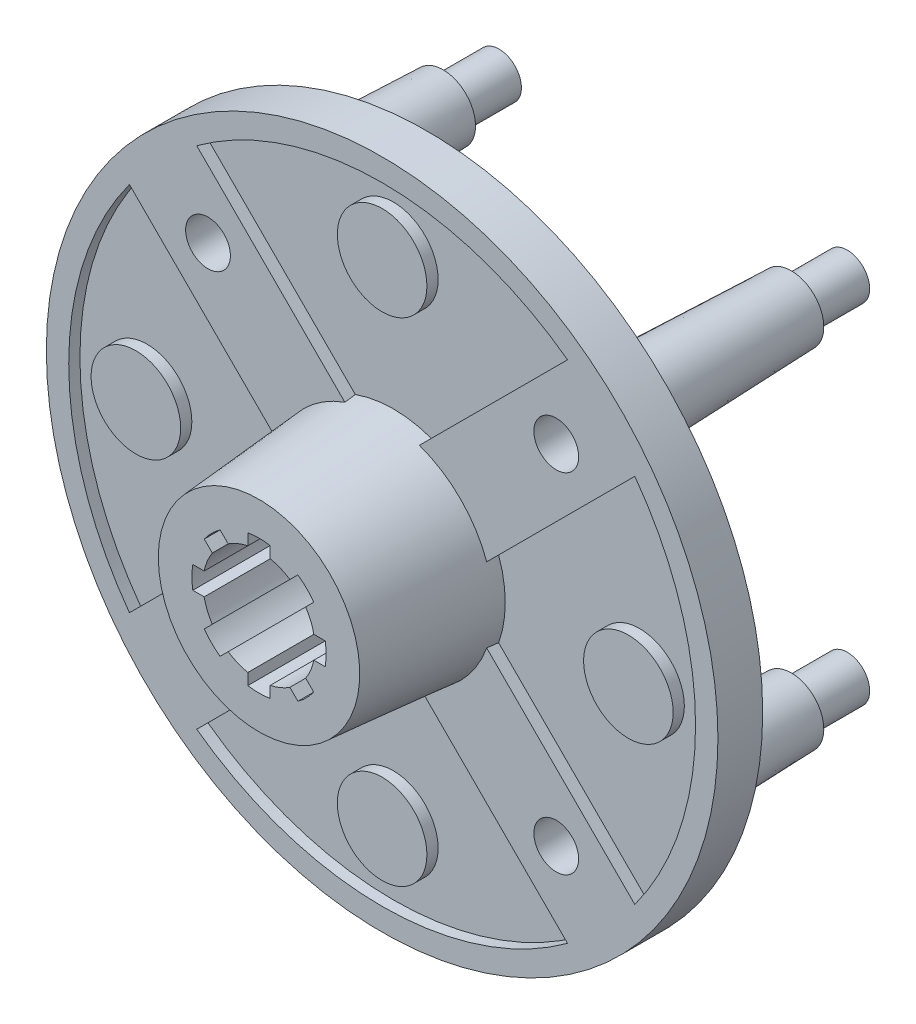
from build123d import *

# Parameters (mm, degrees)
SKETCH_1_R               = 30
EXTRUDE_1_DEPTH          = 4
SKETCH_2_R               = 28
CUT_EXTRUDE_1_DEPTH      = 1
EXTRUDE_1_2_DEPTH        = 1
PATTERN_CIRCULAR_1_COUNT = 4
SKETCH_4_R               = 10
SKETCH_5_R               = 9
EXTRUDE_START            = -6
SKETCH_6_R               = 4
EXTRUDE_2_DEPTH          = 7
SKETCH_8_R               = 2.5
CUT_EXTRUDE_2_DEPTH      = 4
PATTERN_CIRCULAR_2_COUNT = 4
SKETCH_9_R               = 2
CUT_EXTRUDE_3_DEPTH      = 44.829214027
PATTERN_CIRCULAR_3_COUNT = 4
SKETCH_10_R              = 5
CUT_EXTRUDE_4_DEPTH      = 47.086874487
CUT_EXTRUDE_5_DEPTH      = 47.086874487
PATTERN_CIRCULAR_4_COUNT = 8
SKETCH_12_R              = 3.5
SKETCH_13_R              = 2.9
SKETCH_14_R              = 2
EXTRUDE_3_DEPTH          = 5
SKETCH_15_R              = 1.5
CUT_EXTRUDE_6_DEPTH      = 3
PATTERN_CIRCULAR_5_COUNT = 4


with BuildPart() as part:
    # 草图1 → Extrude 1 (new body)
    with BuildSketch(Plane.XY):
        Circle(SKETCH_1_R)
    extrude(amount=EXTRUDE_1_DEPTH)

    # 草图2 → 切除-拉伸1 (cut)
    with BuildSketch(Plane.XY.offset(4)):
        Circle(SKETCH_2_R)
    extrude(amount=-CUT_EXTRUDE_1_DEPTH, mode=Mode.SUBTRACT)

    # 草图3 → Extrude 1 2 (add)
    with BuildSketch(Plane.XY.offset(3)):
        Polygon((3.00520382, 3.00520382), (-16.793786053, 22.804193693), (-22.804193693, 16.793786053), (-3.00520382, -3.00520382), align=None)
    extrude_1_2 = extrude(amount=EXTRUDE_1_2_DEPTH)

    # 阵列(圆周)1: Extrude 1 2 ×4 about axis
    pattern_circular_1_axis = Axis((0, 0, 0), (0, 0, 1))
    for i in range(1, PATTERN_CIRCULAR_1_COUNT):
        add(extrude_1_2.rotate(pattern_circular_1_axis, i * 360 / PATTERN_CIRCULAR_1_COUNT))

    # 草图4 → 放样1 section 0
    with BuildSketch(Plane.XY.offset(3)):
        Circle(SKETCH_4_R)
    # 草图5 → 放样1 section 1
    with BuildSketch(Plane(origin=(0, 0, 15), x_dir=(-1, 0, 0), z_dir=(0, 0, -1))):
        Circle(SKETCH_5_R)
    loft()

    # 草图6 → 凸台-拉伸2 (add)
    with BuildSketch(Plane.XY.offset(3).offset(EXTRUDE_START)):
        with Locations((0, 22)):
            Circle(SKETCH_6_R)
    extrude_2 = extrude(amount=EXTRUDE_2_DEPTH)

    # 草图8 → 切除-拉伸2 (cut)
    with BuildSketch(Plane(origin=(0, 0, -3), x_dir=(-1, 0, 0), z_dir=(0, 0, -1))):
        with Locations((0, 22)):
            Circle(SKETCH_8_R)
    cut_extrude_2 = extrude(amount=-CUT_EXTRUDE_2_DEPTH, mode=Mode.SUBTRACT)

    # 阵列(圆周)2: 凸台-拉伸2, 切除-拉伸2 ×4 about axis
    pattern_circular_2_axis = Axis((0, 0, 0), (0, 0, 1))
    add([extrude_2.rotate(pattern_circular_2_axis, i * 360 / PATTERN_CIRCULAR_2_COUNT) for i in range(1, PATTERN_CIRCULAR_2_COUNT)])
    add([cut_extrude_2.rotate(pattern_circular_2_axis, i * 360 / PATTERN_CIRCULAR_2_COUNT) for i in range(1, PATTERN_CIRCULAR_2_COUNT)], mode=Mode.SUBTRACT)

    # 草图9 → 切除-拉伸3 (cut, through all)
    with BuildSketch(Plane.XY.offset(4)):
        with Locations((-15.556349269, 15.556349103)):
            Circle(SKETCH_9_R)
    cut_extrude_3 = extrude(amount=-CUT_EXTRUDE_3_DEPTH, mode=Mode.SUBTRACT)

    # 阵列(圆周)3: 切除-拉伸3 ×4 about axis
    pattern_circular_3_axis = Axis((0, 0, 0), (0, 0, 1))
    for i in range(1, PATTERN_CIRCULAR_3_COUNT):
        add(cut_extrude_3.rotate(pattern_circular_3_axis, i * 360 / PATTERN_CIRCULAR_3_COUNT), mode=Mode.SUBTRACT)

    # 草图10 → 切除-拉伸4 (cut, through all)
    with BuildSketch(Plane.XY.offset(15)):
        Circle(SKETCH_10_R)
    extrude(amount=-CUT_EXTRUDE_4_DEPTH, mode=Mode.SUBTRACT)

    # 草图11 → 切除-拉伸5 (cut, through all)
    with BuildSketch(Plane.XY.offset(15)):
        with BuildLine():
            Line((1, -5.916079783), (1, 5.916079783))
            ThreePointArc((1, 5.916079783), (0, 6), (-1, 5.916079783))
            Line((-1, 5.916079783), (-1, -5.916079783))
            ThreePointArc((-1, -5.916079783), (0, -6), (1, -5.916079783))
        make_face()
    cut_extrude_5 = extrude(amount=-CUT_EXTRUDE_5_DEPTH, mode=Mode.SUBTRACT)

    # 阵列(圆周)4: 切除-拉伸5 ×8 about axis
    pattern_circular_4_axis = Axis((0, 0, 0), (0, 0, 1))
    for i in range(1, PATTERN_CIRCULAR_4_COUNT):
        add(cut_extrude_5.rotate(pattern_circular_4_axis, i * 360 / PATTERN_CIRCULAR_4_COUNT), mode=Mode.SUBTRACT)

    # 草图12 → 放样2 section 0
    with BuildSketch(Plane(origin=(0, 0, 0), x_dir=(-1, 0, 0), z_dir=(0, 0, -1))):
        with Locations((-15.556349186, 15.556349186)):
            Circle(SKETCH_12_R)
    # 草图13 → 放样2 section 1
    with BuildSketch(Plane(origin=(0, 0, -17), x_dir=(-1, 0, 0), z_dir=(0, 0, -1))):
        with Locations((-15.556349186, 15.556349186)):
            Circle(SKETCH_13_R)
    loft_2 = loft()

    # 草图14 → 凸台-拉伸3 (add)
    with BuildSketch(Plane(origin=(0, 0, -17), x_dir=(-1, 0, 0), z_dir=(0, 0, -1))):
        with Locations(Location((-15.556349186, 15.556349186, 0), (0, 0, 179.999997613))):
            Circle(SKETCH_14_R)
    extrude_3 = extrude(amount=EXTRUDE_3_DEPTH)

    # 草图15 → 切除-拉伸6 (cut)
    with BuildSketch(Plane(origin=(0, 0, -22), x_dir=(-1, 0, 0), z_dir=(0, 0, -1))):
        with Locations((-15.556349186, 15.556349186)):
            Circle(SKETCH_15_R)
    cut_extrude_6 = extrude(amount=-CUT_EXTRUDE_6_DEPTH, mode=Mode.SUBTRACT)

    # 阵列(圆周)5: 放样2, 凸台-拉伸3, 切除-拉伸6 ×4 about axis
    pattern_circular_5_axis = Axis((0, 0, 0), (0, 0, 1))
    add([loft_2.rotate(pattern_circular_5_axis, i * 360 / PATTERN_CIRCULAR_5_COUNT) for i in range(1, PATTERN_CIRCULAR_5_COUNT)])
    add([extrude_3.rotate(pattern_circular_5_axis, i * 360 / PATTERN_CIRCULAR_5_COUNT) for i in range(1, PATTERN_CIRCULAR_5_COUNT)])
    add([cut_extrude_6.rotate(pattern_circular_5_axis, i * 360 / PATTERN_CIRCULAR_5_COUNT) for i in range(1, PATTERN_CIRCULAR_5_COUNT)], mode=Mode.SUBTRACT)


solid = part.part
